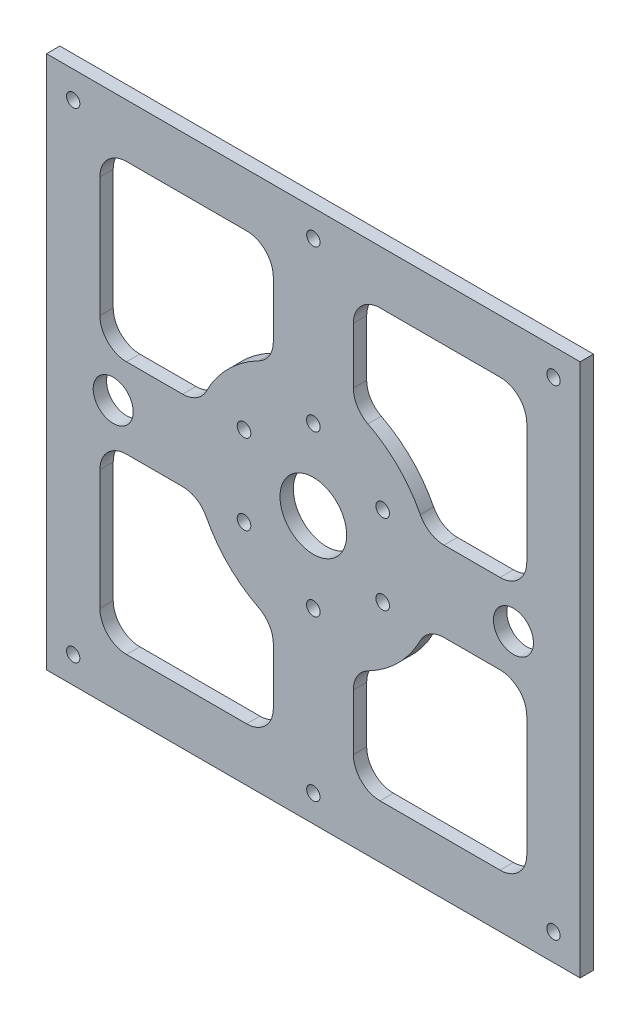
from build123d import *

# Parameters (mm, degrees)
SKETCH_1_W          = 200
SKETCH_1_H          = 200
SKETCH_1_R          = 12.5
EXTRUDE_1_DEPTH     = 5
SKETCH_3_R          = 2.5
CUT_EXTRUDE_2_DEPTH = 142.509716981
SKETCH_4_R          = 2.55
SKETCH_4_R_2        = 7.5
CUT_EXTRUDE_3_DEPTH = 142.509716981
CUT_EXTRUDE_4_DEPTH = 142.509716981


with BuildPart() as part:
    # ｽｹｯﾁ1 → ﾎﾞｽ - 押し出し1 (new body)
    with BuildSketch(Plane.XY):
        Rectangle(SKETCH_1_W, SKETCH_1_H)
        Circle(SKETCH_1_R, mode=Mode.SUBTRACT)
    extrude(amount=EXTRUDE_1_DEPTH)

    # ｽｹｯﾁ3 → ｶｯﾄ - 押し出し2 (cut, through all)
    with BuildSketch(Plane.XY.offset(5)):
        with Locations((0, 90)):
            Circle(SKETCH_3_R)
        with Locations((90, 90)):
            Circle(SKETCH_3_R)
        with Locations((-90, 90)):
            Circle(SKETCH_3_R)
        with Locations((-90, -90)):
            Circle(SKETCH_3_R)
        with Locations((0, -90)):
            Circle(SKETCH_3_R)
        with Locations((90, -90)):
            Circle(SKETCH_3_R)
    extrude(amount=-CUT_EXTRUDE_2_DEPTH, mode=Mode.SUBTRACT)

    # ｽｹｯﾁ4 → ｶｯﾄ - 押し出し3 (cut, through all)
    with BuildSketch(Plane.XY.offset(5)):
        with Locations((0, 30)):
            Circle(SKETCH_4_R)
        with Locations((25.980762114, 15)):
            Circle(SKETCH_4_R)
        with Locations((25.980762114, -15)):
            Circle(SKETCH_4_R)
        with Locations((0, -30)):
            Circle(SKETCH_4_R)
        with Locations((-25.980762114, -15)):
            Circle(SKETCH_4_R)
        with Locations((-25.980762114, 15)):
            Circle(SKETCH_4_R)
        with Locations((-75, 0)):
            Circle(SKETCH_4_R_2)
        with Locations(Location((75, 0, 0), (0, 0, 180))):
            Circle(SKETCH_4_R_2)
    extrude(amount=-CUT_EXTRUDE_3_DEPTH, mode=Mode.SUBTRACT)

    # ｽｹｯﾁ5 → ｶｯﾄ - 押し出し4 (cut, through all)
    with BuildSketch(Plane.XY.offset(5)):
        with BuildLine():
            Line((-80, 70), (-80, 25))
            ThreePointArc((-80, 25), (-77.071067812, 17.928932188), (-70, 15))
            Line((-70, 15), (-48.989794856, 15))
            ThreePointArc((-48.989794856, 15), (-43.767465177, 16.471971346), (-40.082559427, 20.454545455))
            ThreePointArc((-40.082559427, 20.454545455), (-31.819805153, 31.819805153), (-20.454545455, 40.082559427))
            ThreePointArc((-20.454545455, 40.082559427), (-16.471971346, 43.767465177), (-15, 48.989794856))
            Line((-15, 48.989794856), (-15, 70))
            ThreePointArc((-15, 70), (-17.928932188, 77.071067812), (-25, 80))
            Line((-25, 80), (-70, 80))
            ThreePointArc((-70, 80), (-77.071067812, 77.071067812), (-80, 70))
        make_face()
        with BuildLine():
            Line((15, 48.989794856), (15, 70))
            ThreePointArc((15, 70), (17.928932188, 77.071067812), (25, 80))
            Line((25, 80), (70, 80))
            ThreePointArc((70, 80), (77.071067812, 77.071067812), (80, 70))
            Line((80, 70), (80, 25))
            ThreePointArc((80, 25), (77.071067812, 17.928932188), (70, 15))
            Line((70, 15), (48.989794856, 15))
            ThreePointArc((48.989794856, 15), (43.767465177, 16.471971346), (40.082559427, 20.454545455))
            ThreePointArc((40.082559427, 20.454545455), (31.819805153, 31.819805153), (20.454545455, 40.082559427))
            ThreePointArc((20.454545455, 40.082559427), (16.471971346, 43.767465177), (15, 48.989794856))
        make_face()
        with BuildLine():
            Line((15, -48.989794856), (15, -70))
            ThreePointArc((15, -70), (17.928932188, -77.071067812), (25, -80))
            Line((25, -80), (70, -80))
            ThreePointArc((70, -80), (77.071067812, -77.071067812), (80, -70))
            Line((80, -70), (80, -25))
            ThreePointArc((80, -25), (77.071067812, -17.928932188), (70, -15))
            Line((70, -15), (48.989794856, -15))
            ThreePointArc((48.989794856, -15), (43.767465177, -16.471971346), (40.082559427, -20.454545455))
            ThreePointArc((40.082559427, -20.454545455), (31.819805153, -31.819805153), (20.454545455, -40.082559427))
            ThreePointArc((20.454545455, -40.082559427), (16.471971346, -43.767465177), (15, -48.989794856))
        make_face()
        with BuildLine():
            Line((-15, -48.989794856), (-15, -70))
            ThreePointArc((-15, -70), (-17.928932188, -77.071067812), (-25, -80))
            Line((-25, -80), (-70, -80))
            ThreePointArc((-70, -80), (-77.071067812, -77.071067812), (-80, -70))
            Line((-80, -70), (-80, -25))
            ThreePointArc((-80, -25), (-77.071067812, -17.928932188), (-70, -15))
            Line((-70, -15), (-48.989794856, -15))
            ThreePointArc((-48.989794856, -15), (-43.767465177, -16.471971346), (-40.082559427, -20.454545455))
            ThreePointArc((-40.082559427, -20.454545455), (-31.819805153, -31.819805153), (-20.454545455, -40.082559427))
            ThreePointArc((-20.454545455, -40.082559427), (-16.471971346, -43.767465177), (-15, -48.989794856))
        make_face()
    extrude(amount=-CUT_EXTRUDE_4_DEPTH, mode=Mode.SUBTRACT)


solid = part.part
